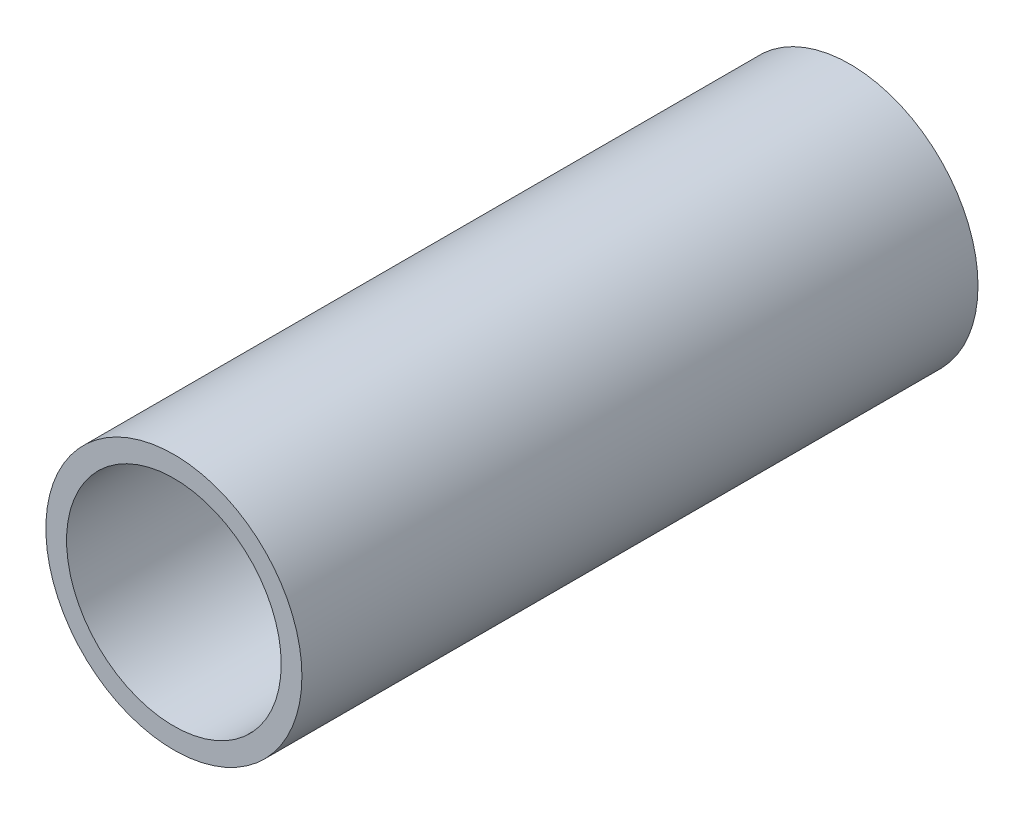
from build123d import *

# Parameters (mm, degrees)
SKETCH1_R           = 30.3
SKETCH1_R_2         = 25.4
BOSS_EXTRUDE1_DEPTH = 160


with BuildPart() as part:
    # Sketch1 → Boss-Extrude1 (new body)
    with BuildSketch(Plane.XY):
        Circle(SKETCH1_R)
        Circle(SKETCH1_R_2, mode=Mode.SUBTRACT)
    extrude(amount=BOSS_EXTRUDE1_DEPTH)


solid = part.part
